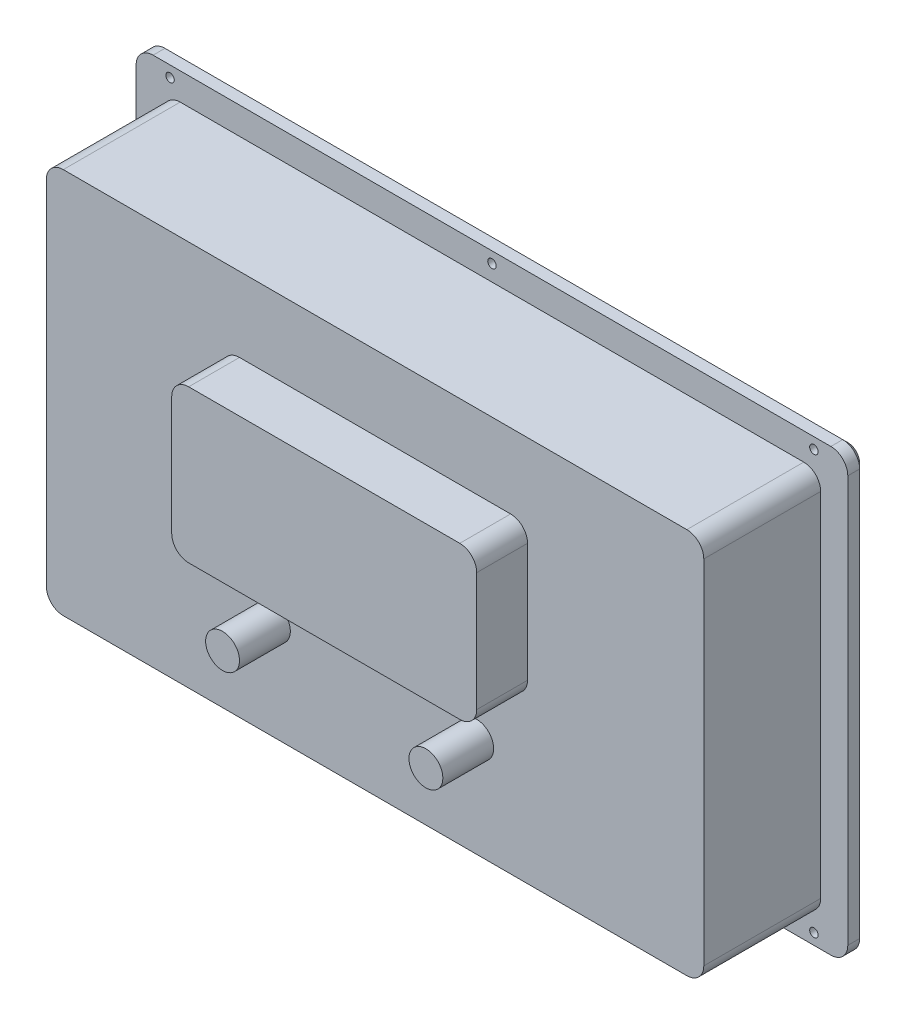
from build123d import *

# Parameters (mm, degrees)
SKETCH_1_W          = 420
SKETCH_1_H          = 260
EXTRUDE_1_DEPTH     = 10
SKETCH_2_W          = 388
SKETCH_2_H          = 228
EXTRUDE_2_DEPTH     = 69
SKETCH_3_R          = 10
SKETCH_3_W          = 180
SKETCH_3_H          = 90
EXTRUDE_3_DEPTH     = 30
SKETCH_4_R          = 2.5
CUT_EXTRUDE_1_DEPTH = 270.964812522
FILLET_1_R          = 10
CUT_EXTRUDE_2_DEPTH = 0.5
CHAMFER_1_SIZE      = 3


with BuildPart() as part:
    # 草图1 → 凸台-拉伸1 (new body)
    with BuildSketch(Plane.XY):
        Rectangle(SKETCH_1_W, SKETCH_1_H)
    extrude(amount=EXTRUDE_1_DEPTH)

    # 草图2 → 凸台-拉伸2 (add)
    with BuildSketch(Plane.XY.offset(10)):
        Rectangle(SKETCH_2_W, SKETCH_2_H)
    extrude(amount=EXTRUDE_2_DEPTH)

    # 草图3 → 凸台-拉伸3 (add)
    with BuildSketch(Plane.XY.offset(79)):
        with Locations(Location((-60, -55, 0), (0, 0, 180))):
            Circle(SKETCH_3_R)
        with Locations(Location((60, -55, 0), (0, 0, 180))):
            Circle(SKETCH_3_R)
        with Locations((0, 25)):
            Rectangle(SKETCH_3_W, SKETCH_3_H)
    extrude(amount=EXTRUDE_3_DEPTH)

    # 草图4 → 切除-拉伸1 (cut, through all)
    with BuildSketch(Plane(origin=(0, 0, 0), x_dir=(-1, 0, 0), z_dir=(0, 0, -1))):
        with Locations((-190, 123.5)):
            Circle(SKETCH_4_R)
        with Locations((0, 123.5)):
            Circle(SKETCH_4_R)
        with Locations((190, 123.5)):
            Circle(SKETCH_4_R)
        with Locations((190, -123.5)):
            Circle(SKETCH_4_R)
        with Locations((0, -123.5)):
            Circle(SKETCH_4_R)
        with Locations((-190, -123.5)):
            Circle(SKETCH_4_R)
    extrude(amount=-CUT_EXTRUDE_1_DEPTH, mode=Mode.SUBTRACT)

    # 圆角1
    fillet_1_edges = [part.edges().sort_by_distance(p)[0] for p in [
        (194, -114, 44.5),
        (194, 114, 44.5),
        (-194, 114, 44.5),
        (-194, -114, 44.5),
        (90, -20, 94),
        (90, 70, 94),
        (-90, 70, 94),
        (-90, -20, 94),
        (210, -130, 5),
        (-210, -130, 5),
        (-210, 130, 5),
        (210, 130, 5),
    ]]
    fillet(fillet_1_edges, radius=FILLET_1_R)

    # 草图5 → 切除-拉伸2 (cut)
    with BuildSketch(Plane(origin=(0, 0, 0), x_dir=(-1, 0, 0), z_dir=(0, 0, -1))):
        with BuildLine():
            Line((-165, 0), (-15, 0))
            ThreePointArc((-15, 0), (-11.464466094, 1.464466094), (-10, 5))
            Line((-10, 5), (-10, 95))
            ThreePointArc((-10, 95), (-11.464466094, 98.535533906), (-15, 100))
            Line((-15, 100), (-165, 100))
            ThreePointArc((-165, 100), (-168.535533906, 98.535533906), (-170, 95))
            Line((-170, 95), (-170, 5))
            ThreePointArc((-170, 5), (-168.535533906, 1.464466094), (-165, 0))
        make_face()
        with BuildLine():
            Line((45, 0), (135, 0))
            ThreePointArc((135, 0), (138.535533906, 1.464466094), (140, 5))
            Line((140, 5), (140, 95))
            ThreePointArc((140, 95), (138.535533906, 98.535533906), (135, 100))
            Line((135, 100), (45, 100))
            ThreePointArc((45, 100), (41.464466094, 98.535533906), (40, 95))
            Line((40, 95), (40, 5))
            ThreePointArc((40, 5), (41.464466094, 1.464466094), (45, 0))
        make_face()
        with BuildLine():
            Line((-145, -80), (145, -80))
            ThreePointArc((145, -80), (148.535533906, -78.535533906), (150, -75))
            Line((150, -75), (150, -35))
            ThreePointArc((150, -35), (148.535533906, -31.464466094), (145, -30))
            Line((145, -30), (-145, -30))
            ThreePointArc((-145, -30), (-148.535533906, -31.464466094), (-150, -35))
            Line((-150, -35), (-150, -75))
            ThreePointArc((-150, -75), (-148.535533906, -78.535533906), (-145, -80))
        make_face()
    extrude(amount=-CUT_EXTRUDE_2_DEPTH, mode=Mode.SUBTRACT)

    # 倒角1
    chamfer_1_edges = [part.edges().sort_by_distance(p)[0] for p in [
        (210, 0, 0),
        (0, -130, 0),
        (-210, 0, 0),
        (0, 130, 0),
        (207.071067812, 127.071067812, 0),
        (-207.071067812, 127.071067812, 0),
        (-207.071067812, -127.071067812, 0),
        (207.071067812, -127.071067812, 0),
    ]]
    chamfer(chamfer_1_edges, length=CHAMFER_1_SIZE)


solid = part.part
